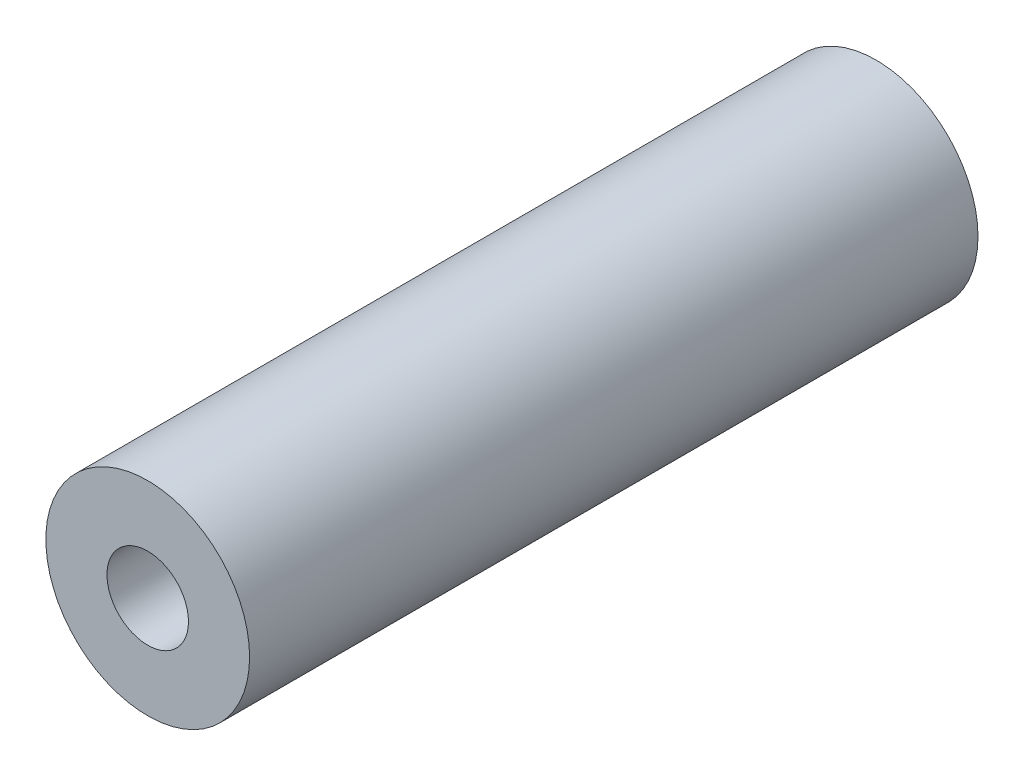
from build123d import *

# Parameters (mm, degrees)
STANDOFF_OD8_ID3P2_PROFILE_R   = 4
STANDOFF_OD8_ID3P2_PROFILE_R_2 = 1.6
STANDOFF_OD8_ID3P2_DEPTH       = 28.6


with BuildPart() as part:
    # Standoff_OD8_ID3p2_profile → Standoff_OD8_ID3p2 (new body)
    with BuildSketch(Plane.XY):
        Circle(STANDOFF_OD8_ID3P2_PROFILE_R)
        Circle(STANDOFF_OD8_ID3P2_PROFILE_R_2, mode=Mode.SUBTRACT)
    extrude(amount=STANDOFF_OD8_ID3P2_DEPTH)


solid = part.part
